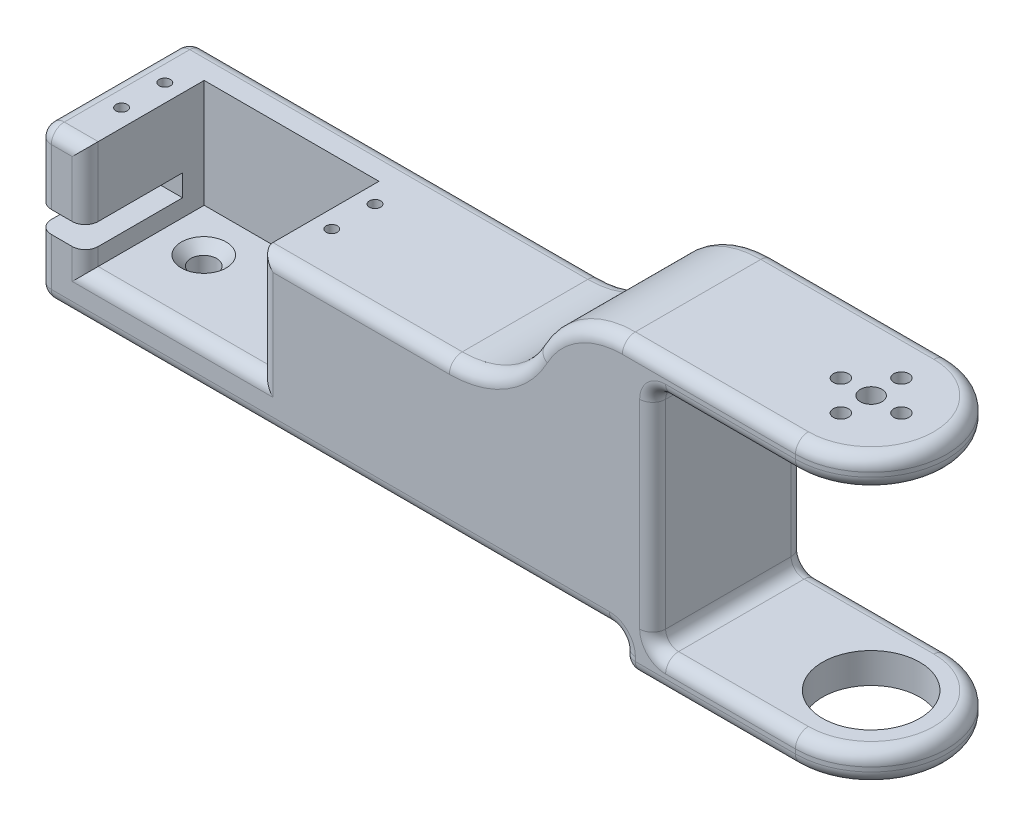
from build123d import *

# Parameters (mm, degrees)
SKETCH1_W           = 135
SKETCH1_H           = 35
BOSS_EXTRUDE1_DEPTH = 35
SKETCH1_3_W         = 40.4
SKETCH1_3_H         = 20
SKETCH1_3_R         = 3.9
SKETCH1_3_H_2       = 7.5
CUT_EXTRUDE1_DEPTH  = 25
SKETCH1_6_R         = 1.3
CUT_EXTRUDE3_DEPTH  = 10
EXTRUDE_THIN1_DEPTH = 35
SKETCH3_R           = 17.5
BOSS_EXTRUDE2_DEPTH = 7
BOSS_EXTRUDE3_START = -66
SKETCH3_3_R         = 17.5
BOSS_EXTRUDE3_DEPTH = 7
BOSS_EXTRUDE6_DEPTH = 35
FILLET3_R           = 3
CUT_EXTRUDE4_REACH  = 186.844
SKETCH4_7_W         = 22.5
SKETCH4_7_H         = 5
SKETCH4_7_W_2       = 3
CUT_EXTRUDE8_DEPTH  = 188.281176052
CUT_EXTRUDE9_START  = -59
CUT_EXTRUDE9_DEPTH  = 2
CUT_EXTRUDE10_REACH = 185.118
SKETCH5_R           = 2.5
SKETCH5_R_2         = 1.75
CIRPATTERN1_COUNT   = 4


with BuildPart() as part:
    # Sketch1 → Boss-Extrude1 (new body)
    with BuildSketch(Plane(origin=(0, 0, 0), x_dir=(1, 0, 0), z_dir=(0, 1, 0))):
        with Locations((46.77, 0)):
            Rectangle(SKETCH1_W, SKETCH1_H)
    extrude(amount=-BOSS_EXTRUDE1_DEPTH)

    # Sketch1<3> → Cut-Extrude1 (cut)
    # profile 1 of 3: a face of its own
    with BuildSketch(Plane(origin=(0, 0, 0), x_dir=(1, 0, 0), z_dir=(0, 1, 0))):
        with Locations((10.3, 0)):
            Rectangle(SKETCH1_3_W, SKETCH1_3_H)
        Circle(SKETCH1_3_R, mode=Mode.SUBTRACT)
    # profile 2 of 3: a face of its own
    with BuildSketch(Plane(origin=(0, 0, 0), x_dir=(1, 0, 0), z_dir=(0, 1, 0))):
        Circle(SKETCH1_3_R)
    # profile 3 of 3: a face of its own
    with BuildSketch(Plane(origin=(0, 0, 0), x_dir=(1, 0, 0), z_dir=(0, 1, 0))):
        with Locations((10.3, -13.75)):
            Rectangle(SKETCH1_3_W, SKETCH1_3_H_2)
    extrude(amount=-CUT_EXTRUDE1_DEPTH, mode=Mode.SUBTRACT)

    # Sketch1<6> → Cut-Extrude3 (cut)
    with BuildSketch(Plane(origin=(0, 0, 0), x_dir=(1, 0, 0), z_dir=(0, 1, 0))):
        with Locations(Location((-14, 5, 0), (0, 0, 270))):
            Circle(SKETCH1_6_R)
        with Locations(Location((-14, -5, 0), (0, 0, 270))):
            Circle(SKETCH1_6_R)
        with Locations(Location((34.6, 5, 0), (0, 0, 270))):
            Circle(SKETCH1_6_R)
        with Locations(Location((34.6, -5, 0), (0, 0, 270))):
            Circle(SKETCH1_6_R)
    extrude(amount=-CUT_EXTRUDE3_DEPTH, mode=Mode.SUBTRACT)

    # Sketch2 → Extrude-Thin1 (add)
    with BuildSketch(Plane.XY.offset(17.5)):
        Polygon((154.27, 24), (114.27, 24), (114.27, -42), (154.27, -42), (154.27, -35), (121.27, -35), (121.27, 17), (154.27, 17), align=None)
    extrude(amount=-EXTRUDE_THIN1_DEPTH)

    # Sketch3 → Boss-Extrude2 (add)
    with BuildSketch(Plane.XZ.offset(42)):
        with Locations((154.27, 0)):
            Circle(SKETCH3_R)
    extrude(amount=-BOSS_EXTRUDE2_DEPTH)

    # Sketch3<3> → Boss-Extrude3 (add)
    with BuildSketch(Plane.XZ.offset(42).offset(BOSS_EXTRUDE3_START)):
        with Locations((154.27, 0)):
            Circle(SKETCH3_3_R)
    extrude(amount=BOSS_EXTRUDE3_DEPTH)

    # Sketch16 → Boss-Extrude6 (add)
    with BuildSketch(Plane.XY.offset(17.5)):
        with BuildLine():
            ThreePointArc((94.27, 12), (85.93190379, 3.230160351), (74.27, 0))
            Line((74.27, 0), (114.27, 0))
            Line((114.27, 0), (114.27, 24))
            ThreePointArc((114.27, 24), (102.60809621, 20.769839649), (94.27, 12))
        make_face()
    extrude(amount=-BOSS_EXTRUDE6_DEPTH)

    # Fillet3
    fillet3_edges = [part.edges().sort_by_distance(p)[0] for p in [
        (46.77, -35, 17.5),
        (52.385, 0, 17.5),
        (-20.73, -35, 0),
        (-9.9, -12.5, 17.5),
        (10.3, -25, 17.5),
        (30.5, -12.5, 17.5),
        (114.27, -42, 0),
        (134.27, 24, 17.5),
        (114.27, -38.5, 17.5),
        (134.27, -42, 17.5),
        (121.27, -9, -17.5),
        (121.27, 17, 0),
        (121.27, -9, 17.5),
        (137.77, 17, -17.5),
        (137.77, 17, 17.5),
        (137.77, -35, -17.5),
        (121.27, -35, 0),
        (137.77, -35, 17.5),
        (134.27, -42, -17.5),
        (114.27, -38.5, -17.5),
        (134.27, 24, -17.5),
        (46.77, -35, -17.5),
        (-20.73, 0, 0),
        (-15.315, 0, 17.5),
        (26.77, 0, -17.5),
        (171.77, -42, 0),
        (171.77, -35, 0),
        (171.77, 17, 0),
        (171.77, 24, 0),
        (-20.73, -17.5, -17.5),
        (-20.73, -17.5, 17.5),
        (102.60809621, 20.769839649, 17.5),
        (85.93190379, 3.230160351, -17.5),
        (85.93190379, 3.230160351, 17.5),
        (102.60809621, 20.769839649, -17.5),
        (114.27, -35, 0),
    ]]
    fillet(fillet3_edges, radius=FILLET3_R)

    # Sketch3<4> → Cut-Extrude4 (cut, up to next)
    with BuildSketch(Plane.XZ.offset(42), mode=Mode.PRIVATE) as cut_extrude4_sk1:
        with BuildLine():
            Line((154.27, -11.25), (154.27, 11.25))
            ThreePointArc((154.27, 11.25), (143.02, 0), (154.27, -11.25))
        make_face()
    cut_extrude4_tool1 = extrude(cut_extrude4_sk1.sketch, amount=-CUT_EXTRUDE4_REACH, mode=Mode.PRIVATE) & part.part
    # Sketch3<4> → Cut-Extrude4 (cut, up to next)
    with BuildSketch(Plane.XZ.offset(42), mode=Mode.PRIVATE) as cut_extrude4_sk2:
        with BuildLine():
            ThreePointArc((165.52, 0), (162.224951288, 7.954951288), (154.27, 11.25))
            Line((154.27, 11.25), (154.27, -11.25))
            ThreePointArc((154.27, -11.25), (162.224951288, -7.954951288), (165.52, 0))
        make_face()
    cut_extrude4_tool2 = extrude(cut_extrude4_sk2.sketch, amount=-CUT_EXTRUDE4_REACH, mode=Mode.PRIVATE) & part.part
    # Sketch3<4> → Cut-Extrude4 (cut, up to next)
    with BuildSketch(Plane.XZ.offset(42), mode=Mode.PRIVATE) as cut_extrude4_sk3:
        with BuildLine():
            Line((154.27, -11.25), (154.27, 11.25))
            ThreePointArc((154.27, 11.25), (143.02, 0), (154.27, -11.25))
        make_face()
    cut_extrude4_tool3 = extrude(cut_extrude4_sk3.sketch, amount=-CUT_EXTRUDE4_REACH, mode=Mode.PRIVATE) & part.part
    # Sketch3<4> → Cut-Extrude4 (cut, up to next)
    with BuildSketch(Plane.XZ.offset(42), mode=Mode.PRIVATE) as cut_extrude4_sk4:
        with BuildLine():
            ThreePointArc((165.52, 0), (162.224951288, 7.954951288), (154.27, 11.25))
            Line((154.27, 11.25), (154.27, -11.25))
            ThreePointArc((154.27, -11.25), (162.224951288, -7.954951288), (165.52, 0))
        make_face()
    cut_extrude4_tool4 = extrude(cut_extrude4_sk4.sketch, amount=-CUT_EXTRUDE4_REACH, mode=Mode.PRIVATE) & part.part
    add(cut_extrude4_tool1.solids().sort_by_distance((149.495352, -42, 0))[0], mode=Mode.SUBTRACT)
    add(cut_extrude4_tool2.solids().sort_by_distance((159.044648, -42, 0))[0], mode=Mode.SUBTRACT)
    add(cut_extrude4_tool3.solids().sort_by_distance((149.495352, -42, 0))[0], mode=Mode.SUBTRACT)
    add(cut_extrude4_tool4.solids().sort_by_distance((159.044648, -42, 0))[0], mode=Mode.SUBTRACT)

    # Sketch4<7> → Cut-Extrude8 (cut, through all)
    with BuildSketch(Plane(origin=(-9.9, 0, 0), x_dir=(0, 0, -1), z_dir=(1, 0, 0))):
        with Locations((-6.25, -18.5)):
            Rectangle(SKETCH4_7_W, SKETCH4_7_H)
        with Locations((-16, -18.5)):
            Rectangle(SKETCH4_7_W_2, SKETCH4_7_H)
    extrude(amount=-CUT_EXTRUDE8_DEPTH, mode=Mode.SUBTRACT)

    # Sketch3<5> → Cut-Extrude9 (cut)
    with BuildSketch(Plane.XZ.offset(42).offset(CUT_EXTRUDE9_START)):
        with BuildLine():
            Line((154.27, -11.25), (154.27, 11.25))
            ThreePointArc((154.27, 11.25), (143.02, 0), (154.27, -11.25))
        make_face()
        with BuildLine():
            ThreePointArc((165.52, 0), (162.224951288, 7.954951288), (154.27, 11.25))
            Line((154.27, 11.25), (154.27, -11.25))
            ThreePointArc((154.27, -11.25), (162.224951288, -7.954951288), (165.52, 0))
        make_face()
    extrude(amount=-CUT_EXTRUDE9_DEPTH, mode=Mode.SUBTRACT)

    # Sketch5 → Cut-Extrude10 (cut, up to next)
    with BuildSketch(Plane(origin=(0, 19, 0), x_dir=(-1, 0, 0), z_dir=(0, -1, 0)), mode=Mode.PRIVATE) as cut_extrude10_sk1:
        with Locations(Location((-154.27, 0, 0), (0, 0, 180))):
            Circle(SKETCH5_R)
    cut_extrude10_tool1 = extrude(cut_extrude10_sk1.sketch, amount=-CUT_EXTRUDE10_REACH, mode=Mode.PRIVATE) & part.part
    # Sketch5 → Cut-Extrude10 (cut, up to next)
    with BuildSketch(Plane(origin=(0, 19, 0), x_dir=(-1, 0, 0), z_dir=(0, -1, 0)), mode=Mode.PRIVATE) as cut_extrude10_sk2:
        with Locations(Location((-154.27, -7, 0), (0, 0, 180))):
            Circle(SKETCH5_R_2)
    cut_extrude10_tool2 = extrude(cut_extrude10_sk2.sketch, amount=-CUT_EXTRUDE10_REACH, mode=Mode.PRIVATE) & part.part
    cut_extrude10_1 = cut_extrude10_tool1.solids().sort_by_distance((154.27, 19, 0))[0]
    add(cut_extrude10_1, mode=Mode.SUBTRACT)
    cut_extrude10_2 = cut_extrude10_tool2.solids().sort_by_distance((154.27, 19, 7))[0]
    add(cut_extrude10_2, mode=Mode.SUBTRACT)
    cut_extrude10 = cut_extrude10_1 + cut_extrude10_2  # Cut-Extrude10 as one shape, for the pattern or mirror that repeats it

    # CirPattern1: Cut-Extrude10 ×4 about axis
    cirpattern1_axis = Axis((154.27, 0, 0), (0, 1, 0))
    for i in range(1, CIRPATTERN1_COUNT):
        add(cut_extrude10.rotate(cirpattern1_axis, i * 360 / CIRPATTERN1_COUNT), mode=Mode.SUBTRACT)

    # Sketch9 → CSK for M5 Flat Head Machine Screw1 (revolve, cut)
    with BuildSketch(Plane(origin=(0, -25, 0), x_dir=(0, 0, 1), z_dir=(1, 0, 0))):
        Polygon((0, 0), (0, 17), (3, 17), (3, 2.2), (5.2, 0), align=None)
    revolve(axis=Axis((0, -18.65, 0), (0, -1, 0)), mode=Mode.SUBTRACT)


solid = part.part
